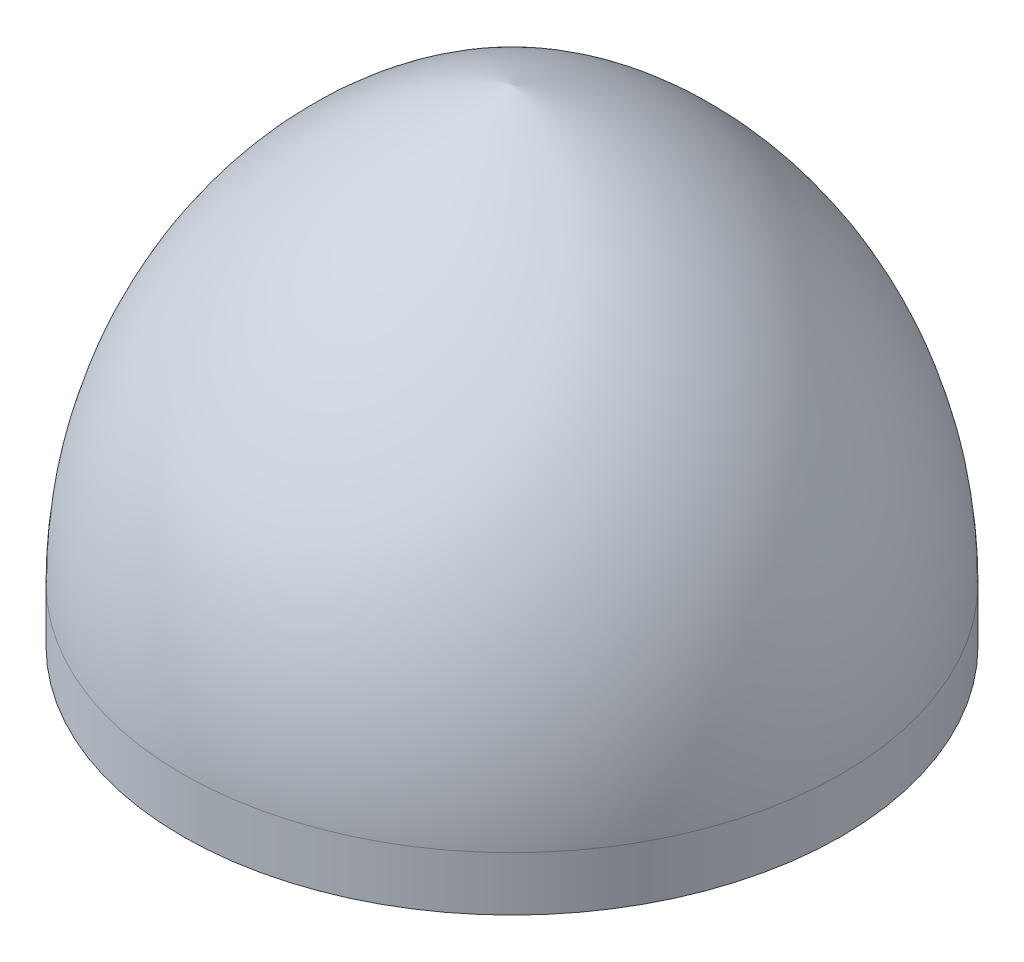
from build123d import *

# Parameters (mm, degrees)
SKETCH2_W      = 3
SKETCH2_H      = 3
REVOLVE8_ANGLE = 3
SKETCH3_W      = 3
SKETCH3_H      = 3
REVOLVE9_ANGLE = 10


with BuildPart() as part:
    # Sketch1 → Revolve7 (revolve)
    with BuildSketch(Plane.XY, mode=Mode.PRIVATE) as revolve7_sk:
        with BuildLine():
            Line((58, 170), (58, 160))
            Line((58, 160), (61, 160))
            Line((61, 160), (61, 170))
            ThreePointArc((61, 170), (44.010282534, 220.301590432), (0, 250))
            Line((0, 250), (0, 246.884627213))
            ThreePointArc((0, 246.884627213), (41.873834296, 218.154039035), (58, 170))
        make_face()
    revolve(revolve7_sk.sketch.rotate(Axis((0, 0, 0), (0, 1, 0)), 90), axis=Axis((0, 0, 0), (0, 1, 0)))

    # Sketch2 → Revolve8 (revolve)
    with BuildSketch(Plane.XY):
        with Locations((56.5, 168.5)):
            Rectangle(SKETCH2_W, SKETCH2_H)
        with Locations((-56.5, 168.5)):
            Rectangle(SKETCH2_W, SKETCH2_H)
    revolve(axis=Axis((0, 250, 0), (0, 1, 0)), revolution_arc=REVOLVE8_ANGLE)

    # Sketch3 → Revolve9 (revolve)
    with BuildSketch(Plane.XY):
        with Locations((53.5, 168.5)):
            Rectangle(SKETCH3_W, SKETCH3_H)
        with Locations((-53.5, 168.5)):
            Rectangle(SKETCH3_W, SKETCH3_H)
    revolve(axis=Axis((0, 250, 0), (0, 1, 0)), revolution_arc=REVOLVE9_ANGLE)


solid = part.part
